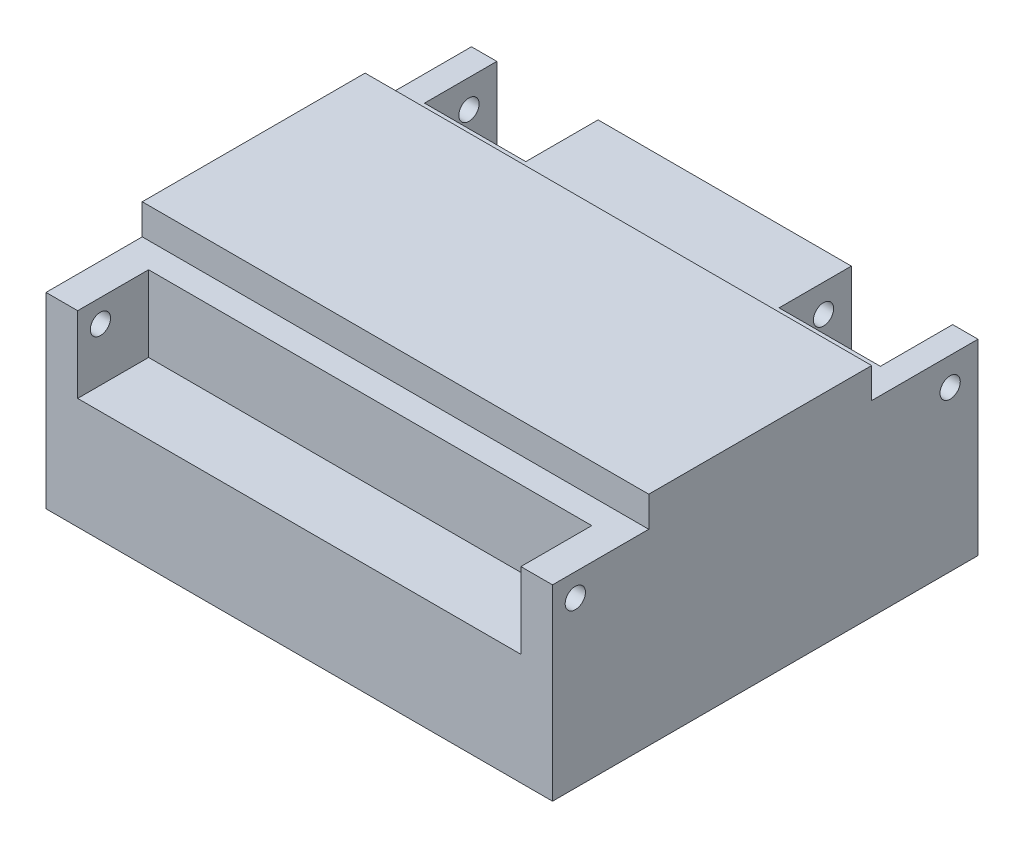
from build123d import *

# Parameters (mm, degrees)
SKETCH1_W           = 100
SKETCH1_H           = 84
BOSS_EXTRUDE1_DEPTH = 6
SKETCH2_W           = 100
SKETCH2_H           = 44
BOSS_EXTRUDE2_DEPTH = 6
SKETCH3_W           = 100
SKETCH3_H           = 84
BOSS_EXTRUDE3_DEPTH = 31
SKETCH4_W           = 30
SKETCH4_H           = 5.699357211
CUT_EXTRUDE1_DEPTH  = 30
SKETCH5_R           = 2
CUT_EXTRUDE2_DEPTH  = 113.805141727
SKETCH6_W           = 87.5
SKETCH6_H           = 26
CUT_EXTRUDE3_DEPTH  = 15
SKETCH7_R           = 2
CUT_EXTRUDE4_DEPTH  = 113.805141727
SKETCH8_W           = 20
SKETCH8_H           = 14.276989135
CUT_EXTRUDE5_DEPTH  = 15


with BuildPart() as part:
    # Sketch1 → Boss-Extrude1 (new body)
    with BuildSketch(Plane(origin=(0, 0, 0), x_dir=(1, 0, 0), z_dir=(0, 1, 0))):
        Rectangle(SKETCH1_W, SKETCH1_H)
    extrude(amount=BOSS_EXTRUDE1_DEPTH)

    # Sketch2 → Boss-Extrude2 (add)
    with BuildSketch(Plane(origin=(0, 6, 0), x_dir=(1, 0, 0), z_dir=(0, 1, 0))):
        with Locations((0, -1)):
            Rectangle(SKETCH2_W, SKETCH2_H)
    extrude(amount=BOSS_EXTRUDE2_DEPTH)

    # Sketch3 → Boss-Extrude3 (add)
    with BuildSketch(Plane.XZ):
        Rectangle(SKETCH3_W, SKETCH3_H)
    extrude(amount=BOSS_EXTRUDE3_DEPTH)

    # Sketch4 → Cut-Extrude1 (cut)
    with BuildSketch(Plane(origin=(0, 0, -42), x_dir=(-1, 0, 0), z_dir=(0, 0, -1))):
        with Locations((0, -2.849678606)):
            Rectangle(SKETCH4_W, SKETCH4_H)
    extrude(amount=-CUT_EXTRUDE1_DEPTH, mode=Mode.SUBTRACT)

    # Sketch5 → Cut-Extrude2 (cut, through all)
    with BuildSketch(Plane.ZY.offset(50)):
        with Locations((37.5, 1.5)):
            Circle(SKETCH5_R)
    extrude(amount=-CUT_EXTRUDE2_DEPTH, mode=Mode.SUBTRACT)

    # Sketch6 → Cut-Extrude3 (cut)
    with BuildSketch(Plane(origin=(0, 6, 0), x_dir=(1, 0, 0), z_dir=(0, 1, 0))):
        with Locations((0, -41)):
            Rectangle(SKETCH6_W, SKETCH6_H)
    extrude(amount=-CUT_EXTRUDE3_DEPTH, mode=Mode.SUBTRACT)

    # Sketch7 → Cut-Extrude4 (cut, through all)
    with BuildSketch(Plane(origin=(50, 0, 0), x_dir=(0, 0, -1), z_dir=(1, 0, 0))):
        with Locations((36.5, 0.5)):
            Circle(SKETCH7_R)
    extrude(amount=-CUT_EXTRUDE4_DEPTH, mode=Mode.SUBTRACT)

    # Sketch8 → Cut-Extrude5 (cut)
    with BuildSketch(Plane(origin=(0, 6, 0), x_dir=(1, 0, 0), z_dir=(0, 1, 0))):
        with Locations((-35, 34.861505433)):
            Rectangle(SKETCH8_W, SKETCH8_H)
        with Locations((35, 34.861505433)):
            Rectangle(SKETCH8_W, SKETCH8_H)
    extrude(amount=-CUT_EXTRUDE5_DEPTH, mode=Mode.SUBTRACT)


solid = part.part
